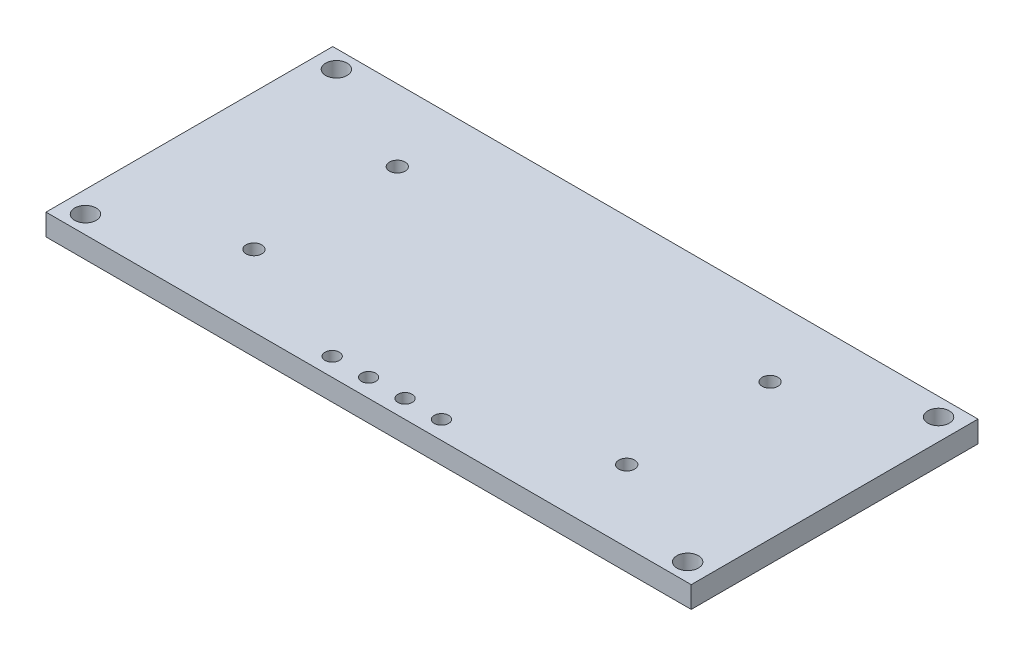
from build123d import *

# Parameters (mm, degrees)
SKETCH1_W   = 45
SKETCH1_H   = 20
SKETCH1_R   = 0.75
PCB_DEPTH   = 1.5
SKETCH2_R   = 0.5
SKETCH2_R_2 = 0.55
HOLES_DEPTH = 2


with BuildPart() as part:
    # Sketch1 → PCB (new body)
    with BuildSketch(Plane(origin=(0, 0, 0), x_dir=(1, 0, 0), z_dir=(0, 1, 0))):
        Rectangle(SKETCH1_W, SKETCH1_H)
        with Locations(Location((-21, 8.75, 0), (0, 0, 270))):
            Circle(SKETCH1_R, mode=Mode.SUBTRACT)
        with Locations(Location((-21, -8.75, 0), (0, 0, 270))):
            Circle(SKETCH1_R, mode=Mode.SUBTRACT)
        with Locations(Location((21, -8.75, 0), (0, 0, 270))):
            Circle(SKETCH1_R, mode=Mode.SUBTRACT)
        with Locations(Location((21, 8.75, 0), (0, 0, 270))):
            Circle(SKETCH1_R, mode=Mode.SUBTRACT)
    extrude(amount=PCB_DEPTH)

    # Sketch2 → Holes (cut)
    with BuildSketch(Plane(origin=(0, 1.5, 0), x_dir=(1, 0, 0), z_dir=(0, 1, 0))):
        with Locations(Location((-3.81, -8.73, 0), (0, 0, 270))):
            Circle(SKETCH2_R)
        with Locations(Location((-1.27, -8.73, 0), (0, 0, 270))):
            Circle(SKETCH2_R)
        with Locations(Location((1.27, -8.73, 0), (0, 0, 270))):
            Circle(SKETCH2_R)
        with Locations(Location((3.81, -8.73, 0), (0, 0, 270))):
            Circle(SKETCH2_R)
        with Locations(Location((13, 5, 0), (0, 0, 270))):
            Circle(SKETCH2_R_2)
        with Locations(Location((13, -5, 0), (0, 0, 270))):
            Circle(SKETCH2_R_2)
        with Locations(Location((-13, -5, 0), (0, 0, 270))):
            Circle(SKETCH2_R_2)
        with Locations(Location((-13, 5, 0), (0, 0, 270))):
            Circle(SKETCH2_R_2)
    extrude(amount=-HOLES_DEPTH, mode=Mode.SUBTRACT)


solid = part.part
